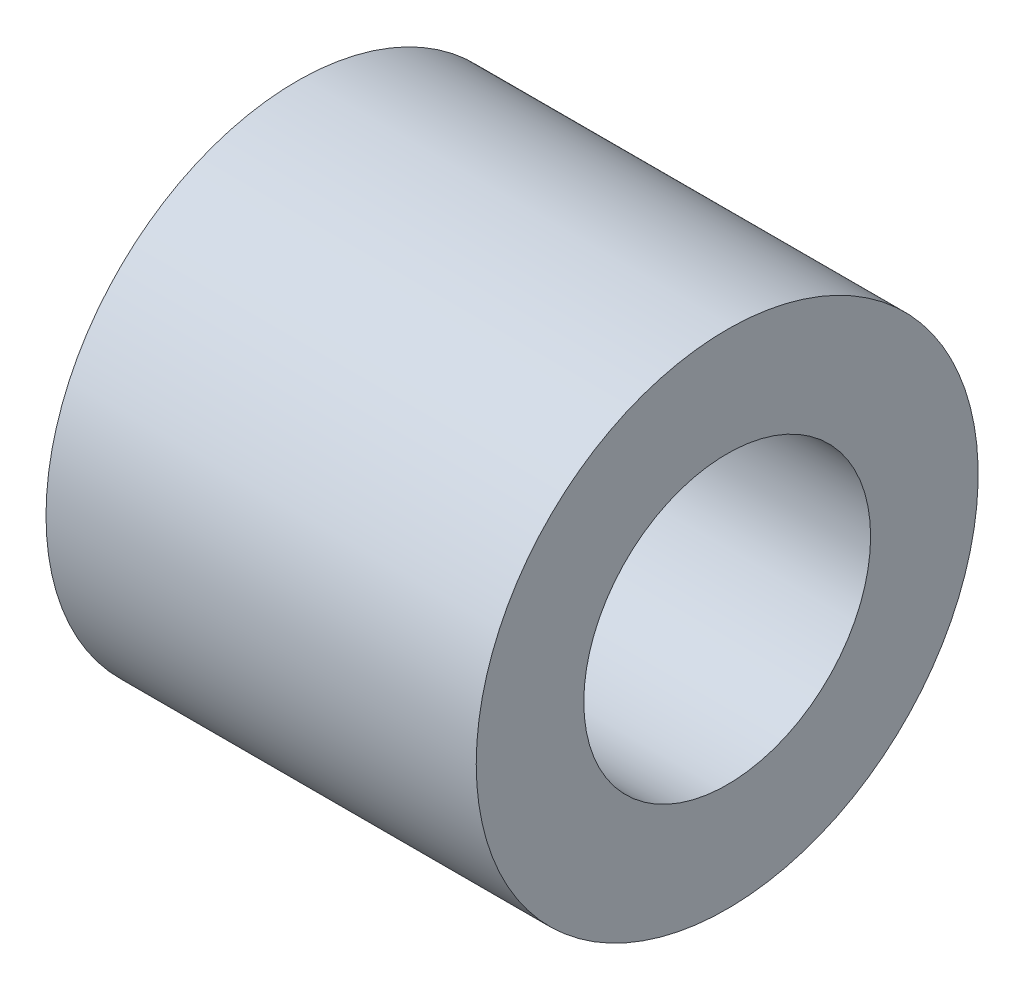
from build123d import *

# Parameters (mm, degrees)
SKETCH2_W = 12
SKETCH2_H = 3


with BuildPart() as part:
    # Sketch2 → Revolve2 (revolve)
    with BuildSketch(Plane.XY, mode=Mode.PRIVATE) as revolve2_sk:
        with Locations((6, 5.5)):
            Rectangle(SKETCH2_W, SKETCH2_H)
    revolve(revolve2_sk.sketch.rotate(Axis((0, 0, 0), (1, 0, 0)), 90), axis=Axis((0, 0, 0), (1, 0, 0)))


solid = part.part
